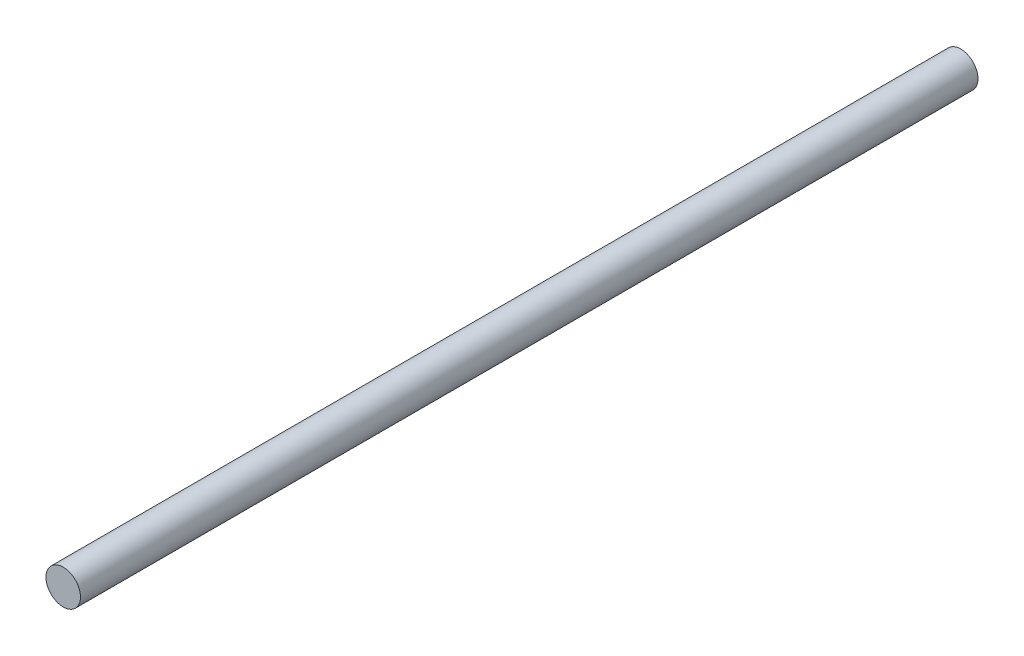
from build123d import *

# Parameters (mm, degrees)
SKETCH1_R           = 4.7625
BOSS_EXTRUDE1_DEPTH = 247.65


with BuildPart() as part:
    # Sketch1 → Boss-Extrude1 (new body)
    with BuildSketch(Plane.XY):
        Circle(SKETCH1_R)
    extrude(amount=BOSS_EXTRUDE1_DEPTH)


solid = part.part
